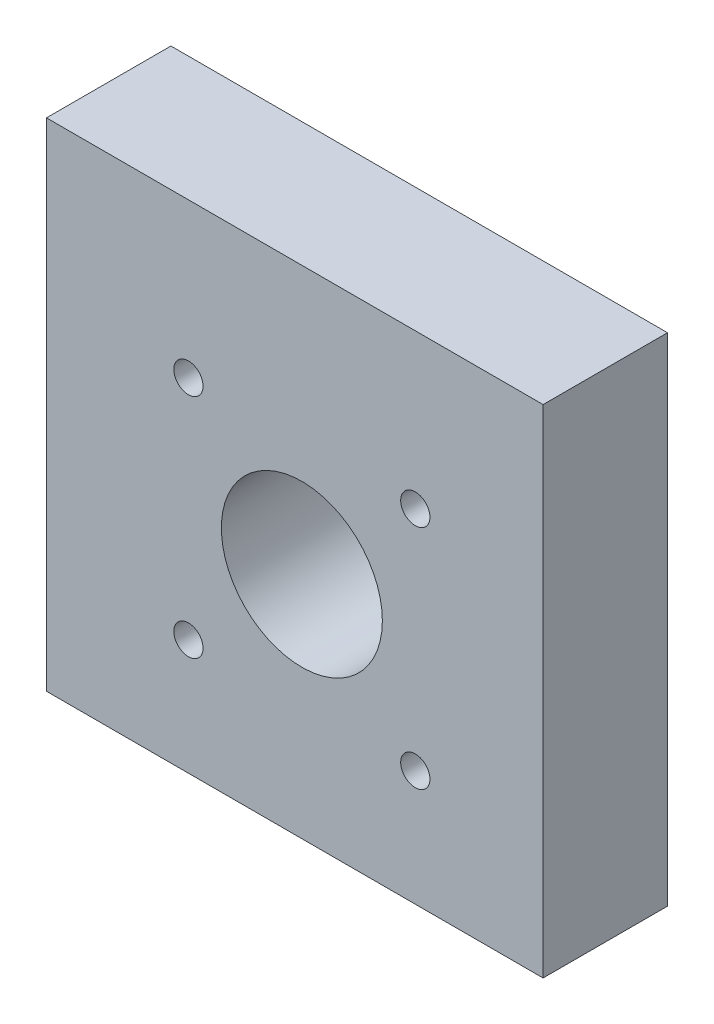
from build123d import *

# Parameters (mm, degrees)
SKETCH_1_W          = 67.85270183
SKETCH_1_H          = 67.85270183
EXTRUDE_1_DEPTH     = 17
SKETCH_2_R          = 11
CUT_EXTRUDE_1_DEPTH = 17
SKETCH_3_R          = 2
CUT_EXTRUDE_2_DEPTH = 17


with BuildPart() as part:
    # 草图1 → 凸台-拉伸1 (new body)
    with BuildSketch(Plane.XY):
        with Locations((-0.966617145, 2.637078742)):
            Rectangle(SKETCH_1_W, SKETCH_1_H)
    extrude(amount=-EXTRUDE_1_DEPTH)

    # 草图2 → 切除-拉伸1 (cut)
    with BuildSketch(Plane.XY):
        Circle(SKETCH_2_R)
    extrude(amount=-CUT_EXTRUDE_1_DEPTH, mode=Mode.SUBTRACT)

    # 草图3 → 切除-拉伸2 (cut)
    with BuildSketch(Plane.XY):
        with Locations((-15.5, 15.5)):
            Circle(SKETCH_3_R)
        with Locations((15.5, 15.5)):
            Circle(SKETCH_3_R)
        with Locations((-15.5, -15.5)):
            Circle(SKETCH_3_R)
        with Locations((15.5, -15.5)):
            Circle(SKETCH_3_R)
    extrude(amount=-CUT_EXTRUDE_2_DEPTH, mode=Mode.SUBTRACT)


solid = part.part
